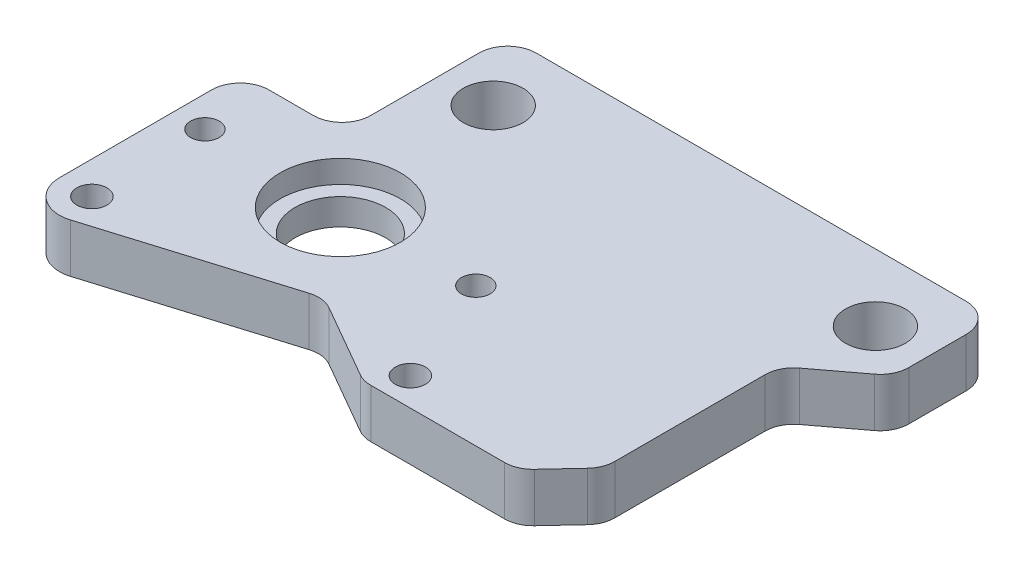
from build123d import *

# Parameters (mm, degrees)
SKETCH4_R           = 8
SKETCH4_R_2         = 3.96875
SKETCH4_R_3         = 2
SKETCH4_R_4         = 1.89865
BOSS_EXTRUDE2_DEPTH = 6.5
BOSS_EXTRUDE5_START = -3.5
SKETCH31_R          = 8
SKETCH31_R_2        = 6.025
BOSS_EXTRUDE5_DEPTH = 3.5


with BuildPart() as part:
    # Sketch4 → Boss-Extrude2 (new body)
    with BuildSketch(Plane(origin=(0, 0, 0), x_dir=(1, 0, 0), z_dir=(0, 1, 0))):
        with BuildLine():
            Line((40.257702493, -18.4375), (22.483900583, -18.4375))
            ThreePointArc((22.483900583, -18.4375), (21.500464498, -18.308390309), (20.583679925, -17.929811531))
            Line((20.583679925, -17.929811531), (10.779476649, -12.288263354))
            ThreePointArc((10.779476649, -12.288263354), (9.307944036, -11.804768953), (7.765559219, -11.946980575))
            Line((7.765559219, -11.946980575), (-16.517810325, -19.369406885))
            ThreePointArc((-16.517810325, -19.369406885), (-20.348558836, -18.710969534), (-22.098, -15.24))
            Line((-22.098, -15.24), (-22.098, 4.987500122))
            ThreePointArc((-22.098, 4.987500122), (-20.982076836, 7.681576958), (-18.288, 8.797500122))
            Line((-18.288, 8.797500122), (-12.3825, 8.797500122))
            ThreePointArc((-12.3825, 8.797500122), (-9.688423164, 9.913423286), (-8.5725, 12.607500122))
            Line((-8.5725, 12.607500122), (-8.5725, 26.9875))
            ThreePointArc((-8.5725, 26.9875), (-7.456576836, 29.681576836), (-4.7625, 30.7975))
            Line((-4.7625, 30.7975), (52.3875, 30.7975))
            ThreePointArc((52.3875, 30.7975), (55.081576836, 29.681576836), (56.1975, 26.9875))
            Line((56.1975, 26.9875), (56.1975, 19.362095927))
            ThreePointArc((56.1975, 19.362095927), (55.797199918, 17.662082259), (54.680415238, 16.319294633))
            Line((54.680415238, 16.319294633), (48.985566477, 12.027918285))
            ThreePointArc((48.985566477, 12.027918285), (47.868781798, 10.685130659), (47.468481715, 8.985116992))
            Line((47.468481715, 8.985116992), (47.468481715, -10.980610773))
            ThreePointArc((47.468481715, -10.980610773), (47.203372649, -12.376980446), (46.444939319, -13.579024524))
            Line((46.444939319, -13.579024524), (43.044160097, -17.225913752))
            ThreePointArc((43.044160097, -17.225913752), (41.776936446, -18.121498883), (40.257702493, -18.4375))
        make_face()
        with Locations(Location((0, 0, 0), (0, 0, 270))):
            Circle(SKETCH4_R, mode=Mode.SUBTRACT)
        with Locations(Location((-1.5875, 21.9075, 0), (0, 0, 270))):
            Circle(SKETCH4_R_2, mode=Mode.SUBTRACT)
        with Locations(Location((49.2125, 21.9075, 0), (0, 0, 270))):
            Circle(SKETCH4_R_2, mode=Mode.SUBTRACT)
        with Locations(Location((24.012521227, -14.703599027, 0), (0, 0, 270))):
            Circle(SKETCH4_R_3, mode=Mode.SUBTRACT)
        with Locations(Location((-17.78, -15.24, 0), (0, 0, 270))):
            Circle(SKETCH4_R_3, mode=Mode.SUBTRACT)
        with Locations(Location((18.000000004, 0, 0), (0, 0, 270))):
            Circle(SKETCH4_R_4, mode=Mode.SUBTRACT)
        with Locations(Location((-18.000000004, 0, 0), (0, 0, 270))):
            Circle(SKETCH4_R_4, mode=Mode.SUBTRACT)
    extrude(amount=-BOSS_EXTRUDE2_DEPTH)

    # Sketch31 → Boss-Extrude5 (add)
    with BuildSketch(Plane.XZ.offset(6.5).offset(BOSS_EXTRUDE5_START)):
        with Locations(Location((0, 0, 0), (0, 0, 90))):
            Circle(SKETCH31_R)
        with Locations(Location((0, 0, 0), (0, 0, 270))):
            Circle(SKETCH31_R_2, mode=Mode.SUBTRACT)
    extrude(amount=BOSS_EXTRUDE5_DEPTH)


solid = part.part
